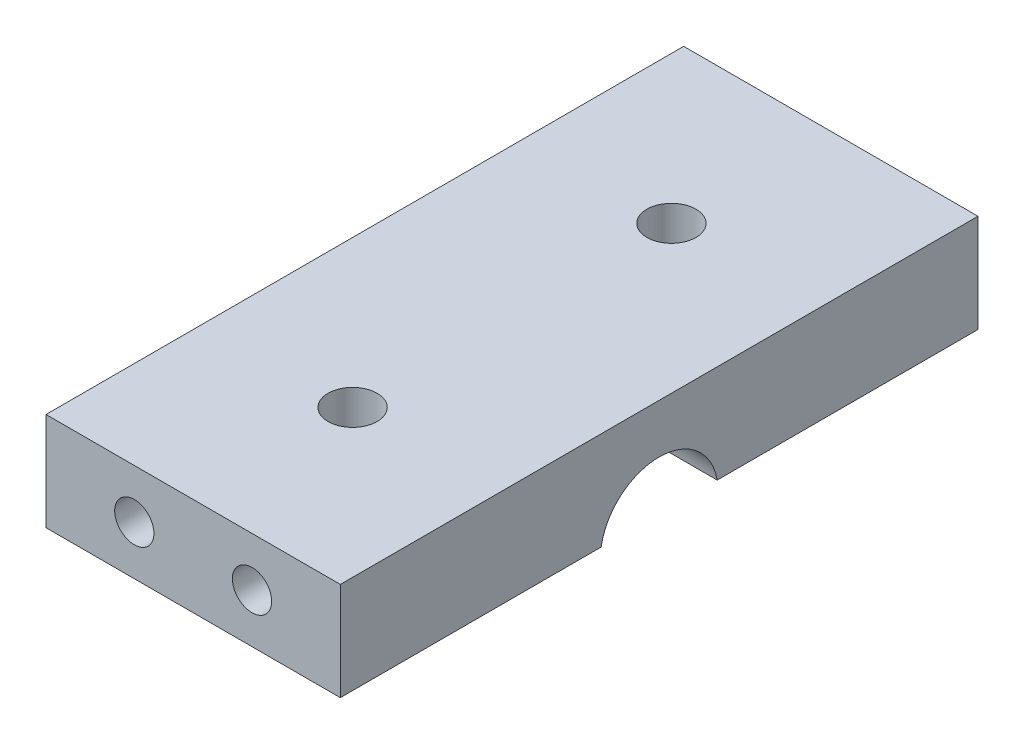
from build123d import *

# Parameters (mm, degrees)
SKETCH_1_W            = 30
SKETCH_1_H            = 65
EXTRUDE_1_DEPTH       = 10
SKETCH_2_R            = 6
CUT_EXTRUDE_2_DEPTH   = 73.284161474
SKETCH_3_R            = 2.5
CUT_EXTRUDE_3_DEPTH   = 73.284161474
SKETCH_4_R            = 2
CUT_EXTRUDE_1_DEPTH   = 20
CUT_EXTRUDE_START     = -20
SKETCH_5_R            = 2
CUT_EXTRUDE_2_2_DEPTH = 20


with BuildPart() as part:
    # Эскиз1 → Вытянуть1 (new body)
    with BuildSketch(Plane(origin=(0, 0, 0), x_dir=(1, 0, 0), z_dir=(0, 1, 0))):
        with Locations((15, 32.5)):
            Rectangle(SKETCH_1_W, SKETCH_1_H)
    extrude(amount=EXTRUDE_1_DEPTH)

    # Эскиз2 → Cut-Extrude 2 (cut, through all)
    with BuildSketch(Plane(origin=(30, 0, 0), x_dir=(0, 0, -1), z_dir=(1, 0, 0))):
        with Locations((32.5, -1)):
            Circle(SKETCH_2_R)
    extrude(amount=-CUT_EXTRUDE_2_DEPTH, mode=Mode.SUBTRACT)

    # Эскиз3 → Вытянуть3 (cut, through all)
    with BuildSketch(Plane(origin=(0, 10, 0), x_dir=(1, 0, 0), z_dir=(0, 1, 0))):
        with Locations(Location((15, 48.75, 0), (0, 0, 270))):
            Circle(SKETCH_3_R)
        with Locations(Location((15, 16.25, 0), (0, 0, 270))):
            Circle(SKETCH_3_R)
    extrude(amount=-CUT_EXTRUDE_3_DEPTH, mode=Mode.SUBTRACT)

    # Эскиз4 → Вырез-Вытянуть1 (cut)
    with BuildSketch(Plane.XY):
        with Locations((9, 5.000000757)):
            Circle(SKETCH_4_R)
        with Locations((21, 5.000000757)):
            Circle(SKETCH_4_R)
    extrude(amount=-CUT_EXTRUDE_1_DEPTH, mode=Mode.SUBTRACT)

    # Эскиз5 → Cut-Extrude 2 2 (cut)
    with BuildSketch(Plane(origin=(0, 0, -65), x_dir=(-1, 0, 0), z_dir=(0, 0, -1)).offset(CUT_EXTRUDE_START)):
        with Locations(Location((-20.999999999, 5.000000369, 0), (0, 0, 179.99998886))):
            Circle(SKETCH_5_R)
        with Locations(Location((-8.999999999, 5.000000369, 0), (0, 0, 179.99998886))):
            Circle(SKETCH_5_R)
    extrude(amount=CUT_EXTRUDE_2_2_DEPTH, mode=Mode.SUBTRACT)


solid = part.part
